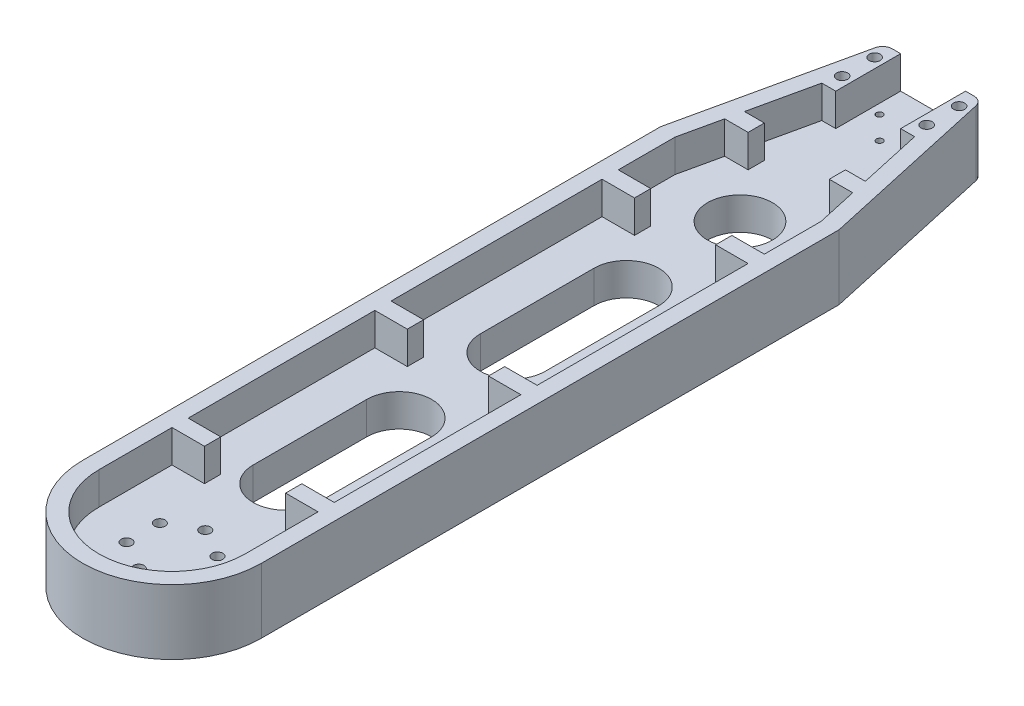
from build123d import *

# Parameters (mm, degrees)
SKETCH_1_R          = 1.65
SKETCH_1_R_2        = 10
EXTRUDE_1_DEPTH     = 10
EXTRUDE_2_DEPTH     = 10
SKETCH_3_W          = 10
SKETCH_3_H          = 5
SKETCH_3_W_2        = 7.225249319
EXTRUDE_3_DEPTH     = 10
SKETCH_4_R          = 1.7
CUT_EXTRUDE_1_DEPTH = 237.952526891
SKETCH_5_R          = 1
CUT_EXTRUDE_2_DEPTH = 237.318640822
SKETCH_7_R          = 2.75
CUT_EXTRUDE_3_DEPTH = 7.5
FILLET_2_R          = 3


with BuildPart() as part:
    # 草图1 → 凸台-拉伸1 (new body)
    with BuildSketch(Plane(origin=(0, 0, 0), x_dir=(1, 0, 0), z_dir=(0, 1, 0))):
        with BuildLine():
            Line((-27.5, 0), (-27.5, 178.006007136))
            Line((-27.5, 178.006007136), (-15, 234.5))
            Line((-15, 234.5), (15, 234.5))
            Line((15, 234.5), (27.5, 178.006007136))
            Line((27.5, 178.006007136), (27.5, 0))
            ThreePointArc((27.5, 0), (0, -27.5), (-27.5, 0))
        make_face()
        with Locations(Location((0, 10.25, 0), (0, 0, 270))):
            Circle(SKETCH_1_R, mode=Mode.SUBTRACT)
        with Locations(Location((8.876760389, 5.125, 0), (0, 0, 270))):
            Circle(SKETCH_1_R, mode=Mode.SUBTRACT)
        with Locations(Location((8.876760389, -5.125, 0), (0, 0, 270))):
            Circle(SKETCH_1_R, mode=Mode.SUBTRACT)
        with Locations(Location((0, -10.25, 0), (0, 0, 270))):
            Circle(SKETCH_1_R, mode=Mode.SUBTRACT)
        with Locations(Location((-8.876760389, -5.125, 0), (0, 0, 270))):
            Circle(SKETCH_1_R, mode=Mode.SUBTRACT)
        with Locations(Location((-8.876760389, 5.125, 0), (0, 0, 270))):
            Circle(SKETCH_1_R, mode=Mode.SUBTRACT)
        with Locations(Location((0, 175, 0), (0, 0, 270))):
            Circle(SKETCH_1_R_2, mode=Mode.SUBTRACT)
        with BuildLine():
            Line((-10, 105), (-10, 140))
            ThreePointArc((-10, 140), (0, 150), (10, 140))
            Line((10, 140), (10, 105))
            ThreePointArc((10, 105), (0, 95), (-10, 105))
        make_face(mode=Mode.SUBTRACT)
        with BuildLine():
            Line((-10, 35), (-10, 70))
            ThreePointArc((-10, 70), (0, 80), (10, 70))
            Line((10, 70), (10, 35))
            ThreePointArc((10, 35), (0, 25), (-10, 35))
        make_face(mode=Mode.SUBTRACT)
    extrude(amount=EXTRUDE_1_DEPTH)

    # 草图2 → 凸台-拉伸2 (add)
    with BuildSketch(Plane(origin=(0, 10, 0), x_dir=(1, 0, 0), z_dir=(0, 1, 0))):
        with BuildLine():
            ThreePointArc((22.5, 0), (0, -22.5), (-22.5, 0))
            Line((-22.5, 0), (-22.5, 177.459460384))
            Line((-22.5, 177.459460384), (-14.304318978, 214.5))
            Line((-14.304318978, 214.5), (-10, 214.5))
            Line((-10, 214.5), (-10, 234.5))
            Line((-10, 234.5), (-15, 234.5))
            Line((-15, 234.5), (-27.5, 178.006007136))
            Line((-27.5, 178.006007136), (-27.5, 0))
            ThreePointArc((-27.5, 0), (0, -27.5), (27.5, 0))
            Line((27.5, 0), (27.5, 178.006007136))
            Line((27.5, 178.006007136), (15, 234.5))
            Line((15, 234.5), (10, 234.5))
            Line((10, 234.5), (10, 214.5))
            Line((10, 214.5), (14.304318978, 214.5))
            Line((14.304318978, 214.5), (22.5, 177.459460384))
            Line((22.5, 177.459460384), (22.5, 0))
        make_face()
    extrude(amount=EXTRUDE_2_DEPTH)

    # 草图3 → 凸台-拉伸3 (add)
    with BuildSketch(Plane(origin=(0, 10, 0), x_dir=(1, 0, 0), z_dir=(0, 1, 0))):
        with Locations((-17.5, 25)):
            Rectangle(SKETCH_3_W, SKETCH_3_H)
        with Locations((17.5, 25)):
            Rectangle(SKETCH_3_W, SKETCH_3_H)
        with Locations((-17.5, 87.5)):
            Rectangle(SKETCH_3_W, SKETCH_3_H)
        with Locations((17.5, 87.5)):
            Rectangle(SKETCH_3_W, SKETCH_3_H)
        with Locations((-17.5, 157.5)):
            Rectangle(SKETCH_3_W, SKETCH_3_H)
        with Locations((17.5, 157.5)):
            Rectangle(SKETCH_3_W, SKETCH_3_H)
        with Locations((-16.112624659, 192.5)):
            Rectangle(SKETCH_3_W_2, SKETCH_3_H)
        with Locations((16.112624659, 192.5)):
            Rectangle(SKETCH_3_W_2, SKETCH_3_H)
    extrude(amount=EXTRUDE_3_DEPTH)

    # 草图4 → 切除-拉伸1 (cut, through all)
    with BuildSketch(Plane(origin=(0, 20, 0), x_dir=(1, 0, 0), z_dir=(0, 1, 0))):
        with Locations(Location((-13.016675417, 229.5, 0), (0, 0, 270))):
            Circle(SKETCH_4_R)
        with Locations(Location((-13.016675417, 219.5, 0), (0, 0, 270))):
            Circle(SKETCH_4_R)
        with Locations(Location((13.016675417, 229.5, 0), (0, 0, 270))):
            Circle(SKETCH_4_R)
        with Locations(Location((13.016675417, 219.5, 0), (0, 0, 270))):
            Circle(SKETCH_4_R)
    extrude(amount=-CUT_EXTRUDE_1_DEPTH, mode=Mode.SUBTRACT)

    # 草图5 → 切除-拉伸2 (cut, through all)
    with BuildSketch(Plane(origin=(0, 10, 0), x_dir=(1, 0, 0), z_dir=(0, 1, 0))):
        with Locations(Location((0, 218, 0), (0, 0, 270))):
            Circle(SKETCH_5_R)
        with Locations(Location((7, 225, 0), (0, 0, 270))):
            Circle(SKETCH_5_R)
        with Locations(Location((-7, 225, 0), (0, 0, 90))):
            Circle(SKETCH_5_R)
    extrude(amount=-CUT_EXTRUDE_2_DEPTH, mode=Mode.SUBTRACT)

    # 草图7 → 切除-拉伸3 (cut)
    with BuildSketch(Plane.XZ):
        with Locations(Location((0, -218, 0), (0, 0, 270))):
            Circle(SKETCH_7_R)
        with Locations(Location((-7, -225, 0), (0, 0, 270))):
            Circle(SKETCH_7_R)
        with Locations(Location((7, -225, 0), (0, 0, 270))):
            Circle(SKETCH_7_R)
    extrude(amount=-CUT_EXTRUDE_3_DEPTH, mode=Mode.SUBTRACT)

    # 圆角2
    fillet_2_edges = [part.edges().sort_by_distance(p)[0] for p in [
        (-15, 10, -234.5),
        (15, 10, -234.5),
    ]]
    fillet(fillet_2_edges, radius=FILLET_2_R)


solid = part.part
